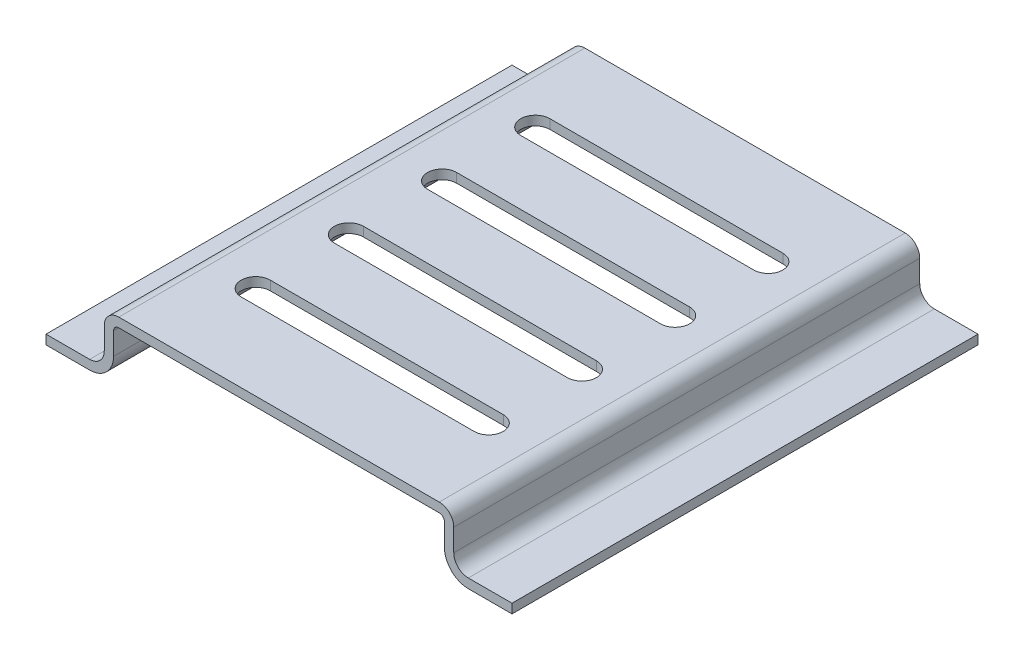
from build123d import *

# Parameters (mm, degrees)
EXTRUDE_THIN1_DEPTH = 101.6
CUT_EXTRUDE1_DEPTH  = 49.784
LPATTERN1_COUNT     = 4
LPATTERN1_PITCH     = 20.32


with BuildPart() as part:
    # Sketch1 → Extrude-Thin1 (new body)
    with BuildSketch(Plane.XY):
        with BuildLine():
            Line((0, 0), (9.525, 0))
            ThreePointArc((9.525, 0), (11.77006403, 0.92993597), (12.7, 3.175))
            Line((12.7, 3.175), (12.7, 7.984742102))
            ThreePointArc((12.7, 7.984742102), (13.62993597, 10.229806132), (15.875, 11.159742102))
            Line((15.875, 11.159742102), (85.725, 11.159742102))
            ThreePointArc((85.725, 11.159742102), (87.97006403, 10.229806132), (88.9, 7.984742102))
            Line((88.9, 7.984742102), (88.9, 3.175))
            ThreePointArc((88.9, 3.175), (89.82993597, 0.92993597), (92.075, 0))
            Line((92.075, 0), (101.6, 0))
            Line((101.6, 0), (101.6, -2.032))
            Line((101.6, -2.032), (92.075, -2.032))
            ThreePointArc((92.075, -2.032), (88.39309499, -0.50690501), (86.868, 3.175))
            Line((86.868, 3.175), (86.868, 7.984742102))
            ThreePointArc((86.868, 7.984742102), (86.533223051, 8.792965153), (85.725, 9.127742102))
            Line((85.725, 9.127742102), (15.875, 9.127742102))
            ThreePointArc((15.875, 9.127742102), (15.066776949, 8.792965153), (14.732, 7.984742102))
            Line((14.732, 7.984742102), (14.732, 3.175))
            ThreePointArc((14.732, 3.175), (13.20690501, -0.50690501), (9.525, -2.032))
            Line((9.525, -2.032), (0, -2.032))
            Line((0, -2.032), (0, 0))
        make_face()
    extrude(amount=-EXTRUDE_THIN1_DEPTH)

    # Sketch2 → Cut-Extrude1 (cut, symmetric)
    with BuildSketch(Plane(origin=(0, 0, 0), x_dir=(1, 0, 0), z_dir=(0, 1, 0))):
        with BuildLine():
            Line((25.4, 23.495), (76.2, 23.495))
            ThreePointArc((76.2, 23.495), (79.375, 20.32), (76.2, 17.145))
            Line((76.2, 17.145), (25.4, 17.145))
            ThreePointArc((25.4, 17.145), (22.225, 20.32), (25.4, 23.495))
        make_face()
    cut_extrude1 = extrude(amount=CUT_EXTRUDE1_DEPTH, both=True, mode=Mode.SUBTRACT)

    # LPattern1: Cut-Extrude1 ×4
    with Locations(*[(0, 0, -i * LPATTERN1_PITCH) for i in range(1, LPATTERN1_COUNT)]):
        add(cut_extrude1, mode=Mode.SUBTRACT)


solid = part.part
